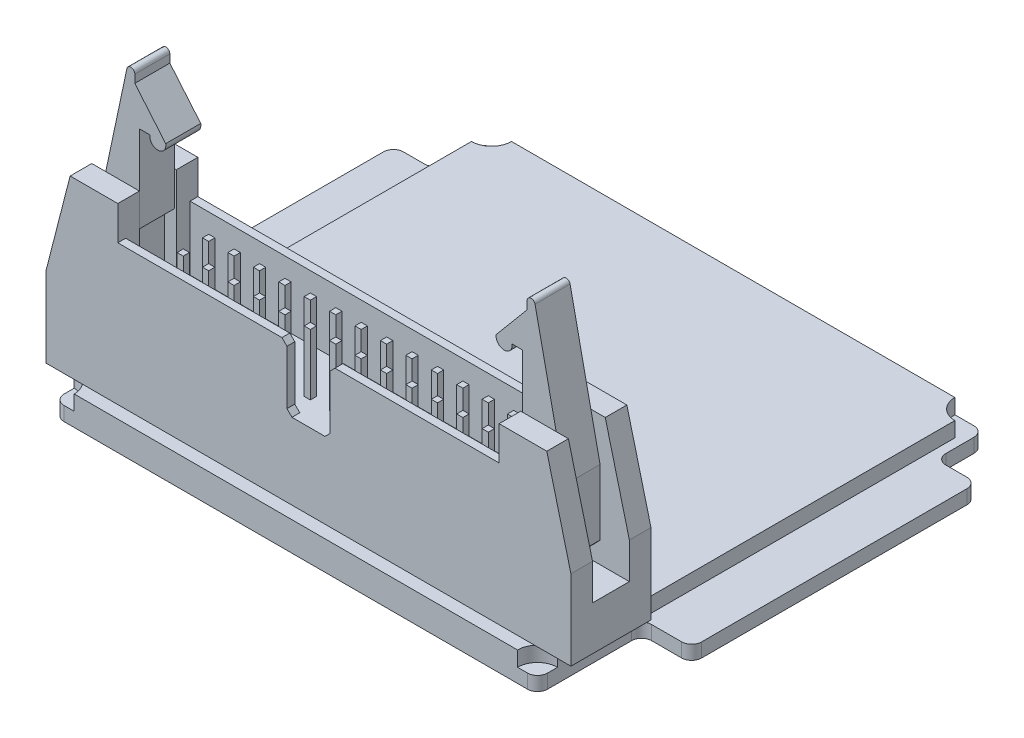
from build123d import *

# Parameters (mm, degrees)
BOSS_EXTRUDE1_DEPTH      = 4
BOSS_EXTRUDE1_DEPTH_BACK = 4
SKETCH2_W                = 38.1
SKETCH2_H                = 6.43
CUT_EXTRUDE1_DEPTH       = 6.4
CUT_EXTRUDE2_DEPTH       = 1.5
CUT_EXTRUDE3_DEPTH       = 7.2
CUT_EXTRUDE3_DEPTH_BACK  = 7.2
SKETCH4_W                = 3.68
SKETCH4_H                = 13
CUT_EXTRUDE4_DEPTH       = 7.2
CUT_EXTRUDE4_DEPTH_BACK  = 7.2
SKETCH5_W                = 3.68
SKETCH5_H                = 13
BOSS_EXTRUDE2_DEPTH      = 3.8
BOSS_EXTRUDE2_DEPTH_BACK = 3.8
SKETCH6_R                = 0.5
BOSS_EXTRUDE3_DEPTH      = 1.75
BOSS_EXTRUDE3_DEPTH_BACK = 1.75
BOSS_EXTRUDE4_DEPTH      = 1.9
BOSS_EXTRUDE4_DEPTH_BACK = 1.9
SKETCH8_R                = 0.5
BOSS_EXTRUDE5_DEPTH      = 1.75
BOSS_EXTRUDE5_DEPTH_BACK = 1.75
SKETCH10_W               = 0.62
SKETCH10_H               = 0.62
BOSS_EXTRUDE6_DEPTH      = 6.1
SKETCH11_W               = 0.62
SKETCH11_H               = 0.62
BOSS_EXTRUDE7_DEPTH      = 6.1
SKETCH12_W               = 0.62
SKETCH12_H               = 0.62
BOSS_EXTRUDE8_DEPTH      = 6.1
SKETCH13_W               = 0.62
SKETCH13_H               = 0.62
BOSS_EXTRUDE9_DEPTH      = 6.1
SKETCH14_W               = 0.62
SKETCH14_H               = 0.62
BOSS_EXTRUDE10_DEPTH     = 6.1
SKETCH15_W               = 0.62
SKETCH15_H               = 0.62
BOSS_EXTRUDE11_DEPTH     = 6.1
SKETCH16_W               = 0.62
SKETCH16_H               = 0.62
BOSS_EXTRUDE12_DEPTH     = 6.1
SKETCH17_W               = 0.62
SKETCH17_H               = 0.62
BOSS_EXTRUDE13_DEPTH     = 6.1
SKETCH18_W               = 0.62
SKETCH18_H               = 0.62
BOSS_EXTRUDE14_DEPTH     = 6.1
SKETCH19_W               = 0.62
SKETCH19_H               = 0.62
BOSS_EXTRUDE15_DEPTH     = 6.1
SKETCH20_W               = 0.62
SKETCH20_H               = 0.62
BOSS_EXTRUDE16_DEPTH     = 6.1
SKETCH21_W               = 0.62
SKETCH21_H               = 0.62
BOSS_EXTRUDE17_DEPTH     = 6.1
SKETCH22_W               = 0.62
SKETCH22_H               = 0.62
BOSS_EXTRUDE18_DEPTH     = 6.1
SKETCH23_W               = 0.62
SKETCH23_H               = 0.62
BOSS_EXTRUDE19_DEPTH     = 6.1
SKETCH24_W               = 0.62
SKETCH24_H               = 0.62
BOSS_EXTRUDE20_DEPTH     = 6.1
SKETCH25_W               = 0.62
SKETCH25_H               = 0.62
BOSS_EXTRUDE21_DEPTH     = 6.1
SKETCH26_W               = 0.62
SKETCH26_H               = 0.62
BOSS_EXTRUDE22_DEPTH     = 6.1
SKETCH27_W               = 0.62
SKETCH27_H               = 0.62
BOSS_EXTRUDE23_DEPTH     = 6.1
SKETCH28_W               = 0.62
SKETCH28_H               = 0.62
BOSS_EXTRUDE24_DEPTH     = 6.1
SKETCH29_W               = 0.62
SKETCH29_H               = 0.62
BOSS_EXTRUDE25_DEPTH     = 6.1
SKETCH30_W               = 0.62
SKETCH30_H               = 0.62
BOSS_EXTRUDE26_DEPTH     = 6.1
SKETCH31_W               = 0.62
SKETCH31_H               = 0.62
BOSS_EXTRUDE27_DEPTH     = 6.1
SKETCH32_W               = 0.62
SKETCH32_H               = 0.62
BOSS_EXTRUDE28_DEPTH     = 6.1
SKETCH33_W               = 0.62
SKETCH33_H               = 0.62
BOSS_EXTRUDE29_DEPTH     = 6.1
SKETCH34_W               = 0.62
SKETCH34_H               = 0.62
BOSS_EXTRUDE30_DEPTH     = 6.1
SKETCH35_W               = 0.62
SKETCH35_H               = 0.62
BOSS_EXTRUDE31_DEPTH     = 6.1
BOSS_EXTRUDE32_DEPTH     = 1.5
BOSS_EXTRUDE33_DEPTH     = 1.4


with BuildPart() as part:
    # Sketch1 → Boss-Extrude1 (new, two sides: drawn at the far end of the back side and taken through both)
    with BuildSketch(Plane.XY.offset(-BOSS_EXTRUDE1_DEPTH_BACK)):
        Polygon((-26.225, 8), (-26.225, 0), (26.225, 0), (26.225, 8), (23.815, 17.4), (19.05, 17.4), (19.05, 14), (-19.05, 14), (-19.05, 17.4), (-23.815, 17.4), align=None)
    extrude(amount=BOSS_EXTRUDE1_DEPTH + BOSS_EXTRUDE1_DEPTH_BACK)

    # Sketch2 → Cut-Extrude1 (cut)
    with BuildSketch(Plane(origin=(0, 14, 0), x_dir=(1, 0, 0), z_dir=(0, 1, 0))):
        Rectangle(SKETCH2_W, SKETCH2_H)
    extrude(amount=-CUT_EXTRUDE1_DEPTH, mode=Mode.SUBTRACT)

    # Sketch3 → Cut-Extrude2 (cut)
    with BuildSketch(Plane.XY.offset(4.075)):
        Polygon((-2.65, 14), (-2.15, 13.5), (-2.15, 8.1), (-1.65, 7.6), (1.65, 7.6), (2.15, 8.1), (2.15, 13.5), (2.65, 14), align=None)
    extrude(amount=-CUT_EXTRUDE2_DEPTH, mode=Mode.SUBTRACT)

    # Sketch4 → Cut-Extrude3 (cut, two sides: drawn at the far end of the back side and taken through both)
    with BuildSketch(Plane(origin=(26.225, 0, 0), x_dir=(0, 0, -1), z_dir=(1, 0, 0)).offset(-CUT_EXTRUDE3_DEPTH_BACK)):
        with Locations((0, 10.9)):
            Rectangle(SKETCH4_W, SKETCH4_H)
    extrude(amount=CUT_EXTRUDE3_DEPTH + CUT_EXTRUDE3_DEPTH_BACK, mode=Mode.SUBTRACT)

    # Sketch5 → Cut-Extrude4 (cut, two sides: drawn at the far end of the back side and taken through both)
    with BuildSketch(Plane(origin=(-26.225, 0, 0), x_dir=(0, 0, -1), z_dir=(1, 0, 0)).offset(-CUT_EXTRUDE4_DEPTH_BACK)):
        with Locations((0, 10.9)):
            Rectangle(SKETCH5_W, SKETCH5_H)
    extrude(amount=CUT_EXTRUDE4_DEPTH + CUT_EXTRUDE4_DEPTH_BACK, mode=Mode.SUBTRACT)

    # Sketch6 → Boss-Extrude2 (add, two sides: drawn at the far end of the back side and taken through both)
    with BuildSketch(Plane.XY.offset(-BOSS_EXTRUDE2_DEPTH_BACK)):
        with Locations(Location((22.225, 9.86, 0), (0, 0, 180))):
            Circle(SKETCH6_R)
    extrude(amount=BOSS_EXTRUDE2_DEPTH + BOSS_EXTRUDE2_DEPTH_BACK)

    # Sketch7 → Boss-Extrude3 (add, two sides: drawn at the far end of the back side and taken through both)
    with BuildSketch(Plane.XY.offset(-BOSS_EXTRUDE3_DEPTH_BACK)):
        with BuildLine():
            Line((18.100152425, 22.694506131), (19.155, 22.694506131))
            Line((19.155, 22.694506131), (19.155, 14.023))
            Line((19.155, 14.023), (20.155, 14.023))
            Line((20.155, 14.023), (20.155, 6.62026486))
            ThreePointArc((20.155, 6.62026486), (21.77, 5.8), (23.385, 6.62026486))
            Line((23.385, 6.62026486), (23.385, 13.162181097))
            Line((23.385, 13.162181097), (20.391302756, 27.282958744))
            ThreePointArc((20.391302756, 27.282958744), (19.9582933, 27.597819747), (19.6, 27.2))
            Line((19.6, 27.2), (19.6, 26.4))
            Line((19.6, 26.4), (16.514619474, 22.722986673))
            ThreePointArc((16.514619474, 22.722986673), (17.29056123, 21.772101776), (18.100152425, 22.694506131))
        make_face()
    extrude(amount=BOSS_EXTRUDE3_DEPTH + BOSS_EXTRUDE3_DEPTH_BACK)

    # Sketch8 → Boss-Extrude4 (add, two sides: drawn at the far end of the back side and taken through both)
    with BuildSketch(Plane.XY.offset(-BOSS_EXTRUDE4_DEPTH_BACK)):
        with Locations(Location((-22.225, 9.86, 0), (0, 0, 180))):
            Circle(SKETCH8_R)
    extrude(amount=BOSS_EXTRUDE4_DEPTH + BOSS_EXTRUDE4_DEPTH_BACK)

    # Sketch9 → Boss-Extrude5 (add, two sides: drawn at the far end of the back side and taken through both)
    with BuildSketch(Plane.XY.offset(-BOSS_EXTRUDE5_DEPTH_BACK)):
        with BuildLine():
            Line((-23.385, 13.162181097), (-23.385, 6.62026486))
            ThreePointArc((-23.385, 6.62026486), (-21.77, 5.8), (-20.155, 6.62026486))
            Line((-20.155, 6.62026486), (-20.155, 14.023))
            Line((-20.155, 14.023), (-19.155, 14.023))
            Line((-19.155, 14.023), (-19.155, 22.694506131))
            Line((-19.155, 22.694506131), (-18.100152425, 22.694506131))
            ThreePointArc((-18.100152425, 22.694506131), (-17.29056123, 21.772101776), (-16.514619474, 22.722986673))
            Line((-16.514619474, 22.722986673), (-19.6, 26.4))
            Line((-19.6, 26.4), (-19.6, 27.2))
            ThreePointArc((-19.6, 27.2), (-19.9582933, 27.597819747), (-20.391302756, 27.282958744))
            Line((-20.391302756, 27.282958744), (-23.385, 13.162181097))
        make_face()
    extrude(amount=BOSS_EXTRUDE5_DEPTH + BOSS_EXTRUDE5_DEPTH_BACK)

    # Sketch10 → Boss-Extrude6 (add)
    with BuildSketch(Plane(origin=(0, 7.6, 0), x_dir=(1, 0, 0), z_dir=(0, 1, 0))):
        with Locations((-15.24, -1.27)):
            Rectangle(SKETCH10_W, SKETCH10_H)
    extrude(amount=BOSS_EXTRUDE6_DEPTH)

    # Sketch11 → Boss-Extrude7 (add)
    with BuildSketch(Plane(origin=(0, 7.6, 0), x_dir=(1, 0, 0), z_dir=(0, 1, 0))):
        with Locations((-12.7, -1.27)):
            Rectangle(SKETCH11_W, SKETCH11_H)
    extrude(amount=BOSS_EXTRUDE7_DEPTH)

    # Sketch12 → Boss-Extrude8 (add)
    with BuildSketch(Plane(origin=(0, 7.6, 0), x_dir=(1, 0, 0), z_dir=(0, 1, 0))):
        with Locations((-10.16, -1.27)):
            Rectangle(SKETCH12_W, SKETCH12_H)
    extrude(amount=BOSS_EXTRUDE8_DEPTH)

    # Sketch13 → Boss-Extrude9 (add)
    with BuildSketch(Plane(origin=(0, 7.6, 0), x_dir=(1, 0, 0), z_dir=(0, 1, 0))):
        with Locations((-7.62, -1.27)):
            Rectangle(SKETCH13_W, SKETCH13_H)
    extrude(amount=BOSS_EXTRUDE9_DEPTH)

    # Sketch14 → Boss-Extrude10 (add)
    with BuildSketch(Plane(origin=(0, 7.6, 0), x_dir=(1, 0, 0), z_dir=(0, 1, 0))):
        with Locations((-5.08, -1.27)):
            Rectangle(SKETCH14_W, SKETCH14_H)
    extrude(amount=BOSS_EXTRUDE10_DEPTH)

    # Sketch15 → Boss-Extrude11 (add)
    with BuildSketch(Plane(origin=(0, 7.6, 0), x_dir=(1, 0, 0), z_dir=(0, 1, 0))):
        with Locations((-2.54, -1.27)):
            Rectangle(SKETCH15_W, SKETCH15_H)
    extrude(amount=BOSS_EXTRUDE11_DEPTH)

    # Sketch16 → Boss-Extrude12 (add)
    with BuildSketch(Plane(origin=(0, 7.6, 0), x_dir=(1, 0, 0), z_dir=(0, 1, 0))):
        with Locations((0, -1.27)):
            Rectangle(SKETCH16_W, SKETCH16_H)
    extrude(amount=BOSS_EXTRUDE12_DEPTH)

    # Sketch17 → Boss-Extrude13 (add)
    with BuildSketch(Plane(origin=(0, 7.6, 0), x_dir=(1, 0, 0), z_dir=(0, 1, 0))):
        with Locations((2.54, -1.27)):
            Rectangle(SKETCH17_W, SKETCH17_H)
    extrude(amount=BOSS_EXTRUDE13_DEPTH)

    # Sketch18 → Boss-Extrude14 (add)
    with BuildSketch(Plane(origin=(0, 7.6, 0), x_dir=(1, 0, 0), z_dir=(0, 1, 0))):
        with Locations((5.08, -1.27)):
            Rectangle(SKETCH18_W, SKETCH18_H)
    extrude(amount=BOSS_EXTRUDE14_DEPTH)

    # Sketch19 → Boss-Extrude15 (add)
    with BuildSketch(Plane(origin=(0, 7.6, 0), x_dir=(1, 0, 0), z_dir=(0, 1, 0))):
        with Locations((7.62, -1.27)):
            Rectangle(SKETCH19_W, SKETCH19_H)
    extrude(amount=BOSS_EXTRUDE15_DEPTH)

    # Sketch20 → Boss-Extrude16 (add)
    with BuildSketch(Plane(origin=(0, 7.6, 0), x_dir=(1, 0, 0), z_dir=(0, 1, 0))):
        with Locations((10.16, -1.27)):
            Rectangle(SKETCH20_W, SKETCH20_H)
    extrude(amount=BOSS_EXTRUDE16_DEPTH)

    # Sketch21 → Boss-Extrude17 (add)
    with BuildSketch(Plane(origin=(0, 7.6, 0), x_dir=(1, 0, 0), z_dir=(0, 1, 0))):
        with Locations((12.7, -1.27)):
            Rectangle(SKETCH21_W, SKETCH21_H)
    extrude(amount=BOSS_EXTRUDE17_DEPTH)

    # Sketch22 → Boss-Extrude18 (add)
    with BuildSketch(Plane(origin=(0, 7.6, 0), x_dir=(1, 0, 0), z_dir=(0, 1, 0))):
        with Locations((15.24, -1.27)):
            Rectangle(SKETCH22_W, SKETCH22_H)
    extrude(amount=BOSS_EXTRUDE18_DEPTH)

    # Sketch23 → Boss-Extrude19 (add)
    with BuildSketch(Plane(origin=(0, 7.6, 0), x_dir=(1, 0, 0), z_dir=(0, 1, 0))):
        with Locations((-15.24, 1.27)):
            Rectangle(SKETCH23_W, SKETCH23_H)
    extrude(amount=BOSS_EXTRUDE19_DEPTH)

    # Sketch24 → Boss-Extrude20 (add)
    with BuildSketch(Plane(origin=(0, 7.6, 0), x_dir=(1, 0, 0), z_dir=(0, 1, 0))):
        with Locations((-12.7, 1.27)):
            Rectangle(SKETCH24_W, SKETCH24_H)
    extrude(amount=BOSS_EXTRUDE20_DEPTH)

    # Sketch25 → Boss-Extrude21 (add)
    with BuildSketch(Plane(origin=(0, 7.6, 0), x_dir=(1, 0, 0), z_dir=(0, 1, 0))):
        with Locations((-10.16, 1.27)):
            Rectangle(SKETCH25_W, SKETCH25_H)
    extrude(amount=BOSS_EXTRUDE21_DEPTH)

    # Sketch26 → Boss-Extrude22 (add)
    with BuildSketch(Plane(origin=(0, 7.6, 0), x_dir=(1, 0, 0), z_dir=(0, 1, 0))):
        with Locations((-7.62, 1.27)):
            Rectangle(SKETCH26_W, SKETCH26_H)
    extrude(amount=BOSS_EXTRUDE22_DEPTH)

    # Sketch27 → Boss-Extrude23 (add)
    with BuildSketch(Plane(origin=(0, 7.6, 0), x_dir=(1, 0, 0), z_dir=(0, 1, 0))):
        with Locations((-5.08, 1.27)):
            Rectangle(SKETCH27_W, SKETCH27_H)
    extrude(amount=BOSS_EXTRUDE23_DEPTH)

    # Sketch28 → Boss-Extrude24 (add)
    with BuildSketch(Plane(origin=(0, 7.6, 0), x_dir=(1, 0, 0), z_dir=(0, 1, 0))):
        with Locations((-2.54, 1.27)):
            Rectangle(SKETCH28_W, SKETCH28_H)
    extrude(amount=BOSS_EXTRUDE24_DEPTH)

    # Sketch29 → Boss-Extrude25 (add)
    with BuildSketch(Plane(origin=(0, 7.6, 0), x_dir=(1, 0, 0), z_dir=(0, 1, 0))):
        with Locations((0, 1.27)):
            Rectangle(SKETCH29_W, SKETCH29_H)
    extrude(amount=BOSS_EXTRUDE25_DEPTH)

    # Sketch30 → Boss-Extrude26 (add)
    with BuildSketch(Plane(origin=(0, 7.6, 0), x_dir=(1, 0, 0), z_dir=(0, 1, 0))):
        with Locations((2.54, 1.27)):
            Rectangle(SKETCH30_W, SKETCH30_H)
    extrude(amount=BOSS_EXTRUDE26_DEPTH)

    # Sketch31 → Boss-Extrude27 (add)
    with BuildSketch(Plane(origin=(0, 7.6, 0), x_dir=(1, 0, 0), z_dir=(0, 1, 0))):
        with Locations((5.08, 1.27)):
            Rectangle(SKETCH31_W, SKETCH31_H)
    extrude(amount=BOSS_EXTRUDE27_DEPTH)

    # Sketch32 → Boss-Extrude28 (add)
    with BuildSketch(Plane(origin=(0, 7.6, 0), x_dir=(1, 0, 0), z_dir=(0, 1, 0))):
        with Locations((7.62, 1.27)):
            Rectangle(SKETCH32_W, SKETCH32_H)
    extrude(amount=BOSS_EXTRUDE28_DEPTH)

    # Sketch33 → Boss-Extrude29 (add)
    with BuildSketch(Plane(origin=(0, 7.6, 0), x_dir=(1, 0, 0), z_dir=(0, 1, 0))):
        with Locations((10.16, 1.27)):
            Rectangle(SKETCH33_W, SKETCH33_H)
    extrude(amount=BOSS_EXTRUDE29_DEPTH)

    # Sketch34 → Boss-Extrude30 (add)
    with BuildSketch(Plane(origin=(0, 7.6, 0), x_dir=(1, 0, 0), z_dir=(0, 1, 0))):
        with Locations((12.7, 1.27)):
            Rectangle(SKETCH34_W, SKETCH34_H)
    extrude(amount=BOSS_EXTRUDE30_DEPTH)

    # Sketch35 → Boss-Extrude31 (add)
    with BuildSketch(Plane(origin=(0, 7.6, 0), x_dir=(1, 0, 0), z_dir=(0, 1, 0))):
        with Locations((15.24, 1.27)):
            Rectangle(SKETCH35_W, SKETCH35_H)
    extrude(amount=BOSS_EXTRUDE31_DEPTH)

    # Sketch36 → Boss-Extrude32 (add)
    with BuildSketch(Plane(origin=(0, 0, 0), x_dir=(1, 0, 0), z_dir=(0, 1, 0))):
        with BuildLine():
            Line((-22.15, -5.26), (22.15, -5.26))
            ThreePointArc((22.15, -5.26), (22.735786438, -3.845786438), (24.15, -3.26))
            Line((24.15, -3.26), (24.15, 36.44))
            ThreePointArc((24.15, 36.44), (22.735786438, 37.025786438), (22.15, 38.44))
            Line((22.15, 38.44), (-22.15, 38.44))
            ThreePointArc((-22.15, 38.44), (-22.735786438, 37.025786438), (-24.15, 36.44))
            Line((-24.15, 36.44), (-24.15, -3.26))
            ThreePointArc((-24.15, -3.26), (-22.735786438, -3.845786438), (-22.15, -5.26))
        make_face()
    extrude(amount=-BOSS_EXTRUDE32_DEPTH)

    # Sketch37 → Boss-Extrude33 (add)
    with BuildSketch(Plane(origin=(0, -1.5, 0), x_dir=(1, 0, 0), z_dir=(0, 1, 0))):
        with BuildLine():
            Line((-28.15, 5.14), (-25.15, 5.14))
            ThreePointArc((-25.15, 5.14), (-24.442893219, 4.847106781), (-24.15, 4.14))
            Line((-24.15, 4.14), (-24.15, -4.26))
            ThreePointArc((-24.15, -4.26), (-23.857106781, -4.967106781), (-23.15, -5.26))
            Line((-23.15, -5.26), (23.15, -5.26))
            ThreePointArc((23.15, -5.26), (23.857106781, -4.967106781), (24.15, -4.26))
            Line((24.15, -4.26), (24.15, 4.14))
            ThreePointArc((24.15, 4.14), (24.442893219, 4.847106781), (25.15, 5.14))
            Line((25.15, 5.14), (28.15, 5.14))
            ThreePointArc((28.15, 5.14), (28.857106781, 5.432893219), (29.15, 6.14))
            Line((29.15, 6.14), (29.15, 32.64))
            ThreePointArc((29.15, 32.64), (28.857106781, 33.347106781), (28.15, 33.64))
            Line((28.15, 33.64), (26.05, 33.64))
            ThreePointArc((26.05, 33.64), (25.342893219, 33.932893219), (25.05, 34.64))
            Line((25.05, 34.64), (25.05, 37.44))
            ThreePointArc((25.05, 37.44), (24.757106781, 38.147106781), (24.05, 38.44))
            Line((24.05, 38.44), (-24.05, 38.44))
            ThreePointArc((-24.05, 38.44), (-24.757106781, 38.147106781), (-25.05, 37.44))
            Line((-25.05, 37.44), (-25.05, 34.64))
            ThreePointArc((-25.05, 34.64), (-25.342893219, 33.932893219), (-26.05, 33.64))
            Line((-26.05, 33.64), (-28.15, 33.64))
            ThreePointArc((-28.15, 33.64), (-28.857106781, 33.347106781), (-29.15, 32.64))
            Line((-29.15, 32.64), (-29.15, 6.14))
            ThreePointArc((-29.15, 6.14), (-28.857106781, 5.432893219), (-28.15, 5.14))
        make_face()
    extrude(amount=-BOSS_EXTRUDE33_DEPTH)


solid = part.part
